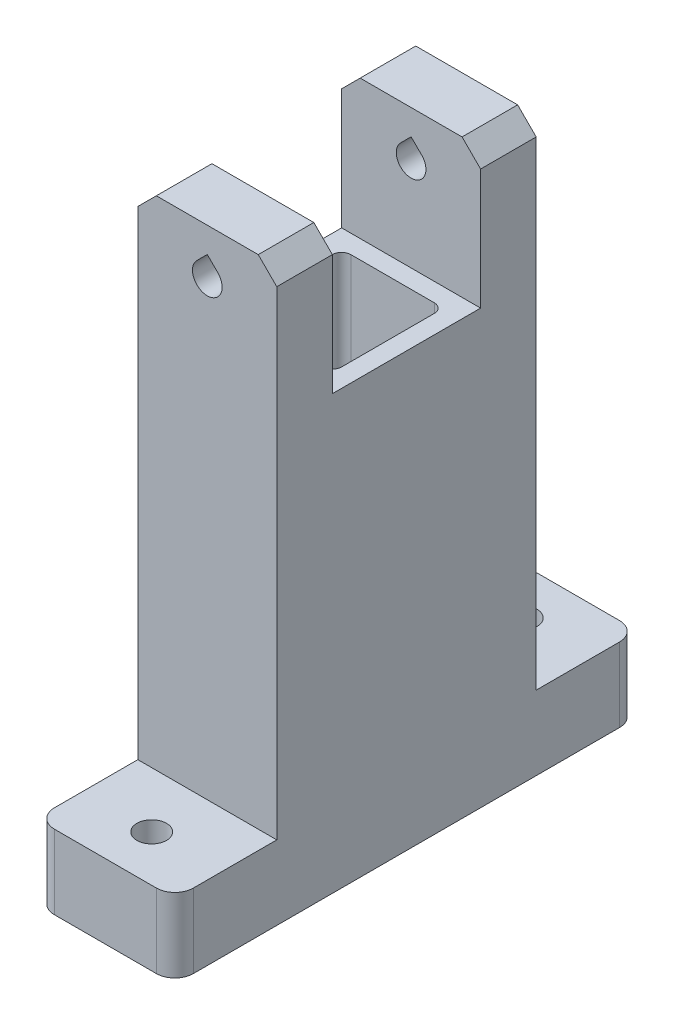
from build123d import *

# Parameters (mm, degrees)
SKETCH_1_W          = 15
SKETCH_1_H          = 61.71
EXTRUDE_1_DEPTH     = 14
SKETCH_2_W          = 16
SKETCH_2_H          = 15
CUT_EXTRUDE_1_DEPTH = 28
SKETCH_3_W          = 15
SKETCH_3_H          = 11
SKETCH_3_R          = 1.6
EXTRUDE_2_DEPTH     = 8
CUT_EXTRUDE_2_DEPTH = 61
CHAMFER_1_SIZE      = 2
FILLET_1_R          = 2


with BuildPart() as part:
    # 草图1 → 凸台-拉伸1 (new, symmetric)
    with BuildSketch(Plane.XY):
        with Locations((0, 30.855)):
            Rectangle(SKETCH_1_W, SKETCH_1_H)
        with BuildLine():
            Line((0, 58.9727417), (-1.13137085, 57.84137085))
            ThreePointArc((-1.13137085, 57.84137085), (0, 55.11), (1.13137085, 57.84137085))
            Line((1.13137085, 57.84137085), (0, 58.9727417))
        make_face(mode=Mode.SUBTRACT)
    extrude(amount=EXTRUDE_1_DEPTH, both=True)

    # 草图2 → 切除-拉伸1 (cut)
    with BuildSketch(Plane.ZY.offset(7.5)):
        with Locations((0, 54.21)):
            Rectangle(SKETCH_2_W, SKETCH_2_H)
    extrude(amount=-CUT_EXTRUDE_1_DEPTH, mode=Mode.SUBTRACT)

    # 草图3 → 凸台-拉伸2 (add)
    # profile 1 of 2: a face of its own
    with BuildSketch(Plane.XZ):
        with Locations((0, 19.5)):
            Rectangle(SKETCH_3_W, SKETCH_3_H)
        with Locations((0, 20)):
            Circle(SKETCH_3_R, mode=Mode.SUBTRACT)
    # profile 2 of 2: a face of its own
    with BuildSketch(Plane.XZ):
        with Locations((0, -19.5)):
            Rectangle(SKETCH_3_W, SKETCH_3_H)
        with Locations(Location((0, -20, 0), (0, 0, 180))):
            Circle(SKETCH_3_R, mode=Mode.SUBTRACT)
    extrude(amount=-EXTRUDE_2_DEPTH)

    # 草图4 → 切除-拉伸2 (cut)
    with BuildSketch(Plane(origin=(0, 46.71, 0), x_dir=(1, 0, 0), z_dir=(0, 1, 0))):
        with BuildLine():
            Line((4.5, -6), (-4.5, -6))
            ThreePointArc((-4.5, -6), (-5.207106781, -5.707106781), (-5.5, -5))
            Line((-5.5, -5), (-5.5, 5))
            ThreePointArc((-5.5, 5), (-5.207106781, 5.707106781), (-4.5, 6))
            Line((-4.5, 6), (4.5, 6))
            ThreePointArc((4.5, 6), (5.207106781, 5.707106781), (5.5, 5))
            Line((5.5, 5), (5.5, -5))
            ThreePointArc((5.5, -5), (5.207106781, -5.707106781), (4.5, -6))
        make_face()
    extrude(amount=-CUT_EXTRUDE_2_DEPTH, mode=Mode.SUBTRACT)

    # 倒角1
    chamfer_1_edges = [part.edges().sort_by_distance(p)[0] for p in [
        (-7.5, 61.71, -11),
        (7.5, 61.71, -11),
        (-7.5, 61.71, 11),
        (7.5, 61.71, 11),
    ]]
    chamfer(chamfer_1_edges, length=CHAMFER_1_SIZE)

    # 圆角1
    fillet_1_edges = [part.edges().sort_by_distance(p)[0] for p in [
        (7.5, 4, 25),
        (-7.5, 4, 25),
        (7.5, 4, -25),
        (-7.5, 4, -25),
    ]]
    fillet(fillet_1_edges, radius=FILLET_1_R)


solid = part.part
